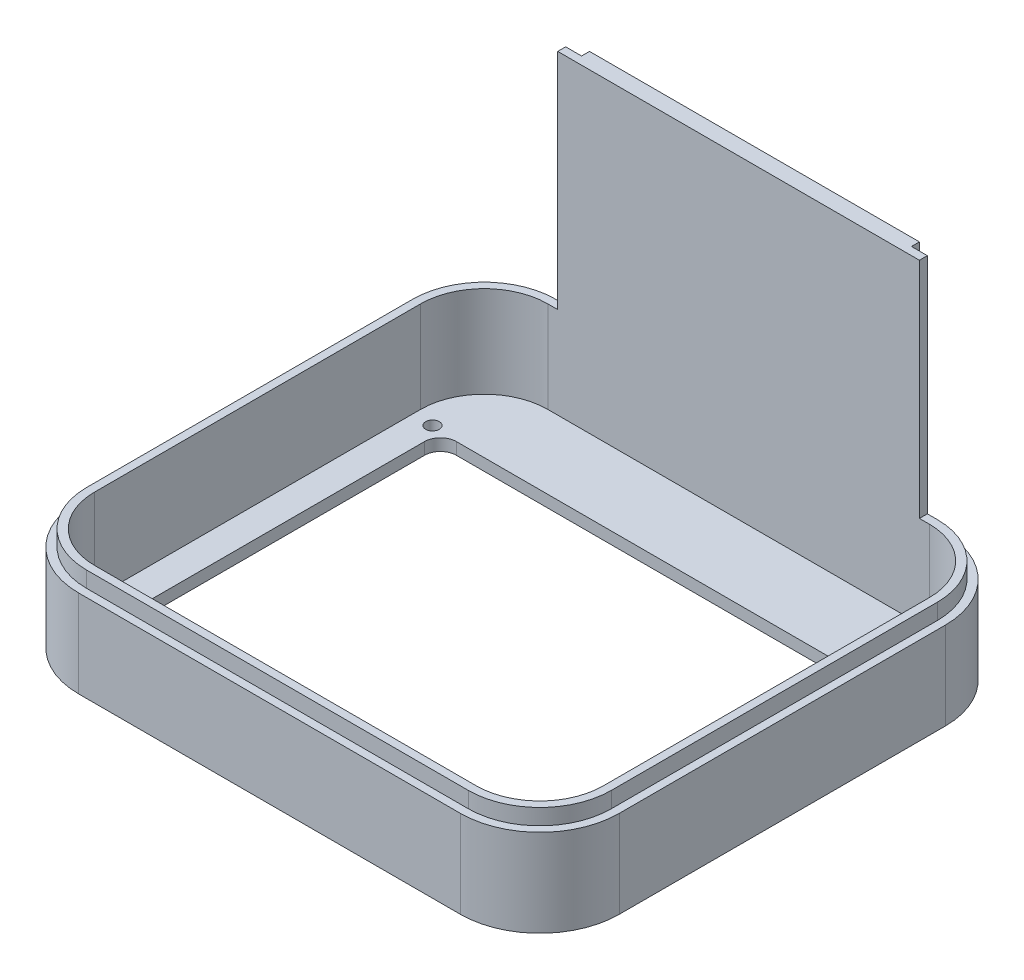
from build123d import *

# Parameters (mm, degrees)
SKETCH1_W                = 136
SKETCH1_H                = 122
BOSS_EXTRUDE1_DEPTH      = 26
FILLET1_R                = 20
SHELL1_T                 = -4
SHELL1_THICKNESS_2_DEPTH = 1
CUT_EXTRUDE1_REACH       = 96.202
SKETCH2_W                = 113
SKETCH2_H                = 77
FILLET2_R                = 4
M3_CLEARANCE_HOLE1_D     = 3.4
CUT_EXTRUDE2_DEPTH       = 4
BOSS_EXTRUDE3_DEPTH      = 56.25


with BuildPart() as part:
    # Sketch1 → Boss-Extrude1 (new body)
    with BuildSketch(Plane(origin=(0, 0, 0), x_dir=(1, 0, 0), z_dir=(0, 1, 0))):
        Rectangle(SKETCH1_W, SKETCH1_H)
    extrude(amount=BOSS_EXTRUDE1_DEPTH)

    # Fillet1
    fillet1_edges = [part.edges().sort_by_distance(p)[0] for p in [
        (68, 13, 61),
        (-68, 13, 61),
        (-68, 13, -61),
        (68, 13, -61),
    ]]
    fillet(fillet1_edges, radius=FILLET1_R)

    # Shell1
    shell1_openings = [part.faces().sort_by_distance(p)[0] for p in [
        (0, 26, 0),
    ]]
    offset(amount=SHELL1_T, openings=shell1_openings, kind=Kind.INTERSECTION)

    # Shell1 thickness 2 face (on inner face of the shell) → Shell1 thickness 2 (cut)
    with BuildSketch(Plane(origin=(0, 4, 0), x_dir=(0, 0, -1), z_dir=(0, -1, 0))):
        with BuildLine():
            ThreePointArc((57, -48), (52.313708499, -59.313708499), (41, -64))
            Line((41, -64), (-41, -64))
            ThreePointArc((-41, -64), (-52.313708499, -59.313708499), (-57, -48))
            Line((-57, -48), (-57, 48))
            ThreePointArc((-57, 48), (-52.313708499, 59.313708499), (-41, 64))
            Line((-41, 64), (41, 64))
            ThreePointArc((41, 64), (52.313708499, 59.313708499), (57, 48))
            Line((57, 48), (57, -48))
        make_face()
    extrude(amount=SHELL1_THICKNESS_2_DEPTH, mode=Mode.SUBTRACT)

    # Sketch2 → Cut-Extrude1 (cut, up to next)
    with BuildSketch(Plane(origin=(0, 3, 0), x_dir=(1, 0, 0), z_dir=(0, 1, 0)), mode=Mode.PRIVATE) as cut_extrude1_sk1:
        Rectangle(SKETCH2_W, SKETCH2_H)
    cut_extrude1_tool1 = extrude(cut_extrude1_sk1.sketch, amount=-CUT_EXTRUDE1_REACH, mode=Mode.PRIVATE) & part.part
    add(cut_extrude1_tool1.solids().sort_by_distance((0, 3, 0))[0], mode=Mode.SUBTRACT)

    # Fillet2
    fillet2_edges = [part.edges().sort_by_distance(p)[0] for p in [
        (56.5, 1.5, -38.5),
        (56.5, 1.5, 38.5),
        (-56.5, 1.5, 38.5),
        (-56.5, 1.5, -38.5),
    ]]
    fillet(fillet2_edges, radius=FILLET2_R)

    # M3 Clearance Hole1 (through all)
    with Locations(Plane(origin=(0, 3, 0), x_dir=(1, 0, 0), z_dir=(0, 1, 0))):
        with Locations((-59, 39), (59, 39), (59, -39), (-59, -39)):
            Hole(M3_CLEARANCE_HOLE1_D / 2)

    # Sketch5 → Cut-Extrude2 (cut)
    with BuildSketch(Plane(origin=(0, 26, 0), x_dir=(1, 0, 0), z_dir=(0, 1, 0))):
        with BuildLine():
            Line((-68, 41), (-68, -41))
            ThreePointArc((-68, -41), (-62.142135624, -55.142135624), (-48, -61))
            Line((-48, -61), (48, -61))
            ThreePointArc((48, -61), (62.142135624, -55.142135624), (68, -41))
            Line((68, -41), (68, 41))
            ThreePointArc((68, 41), (62.142135624, 55.142135624), (48, 61))
            Line((48, 61), (41.5, 61))
            Line((41.5, 61), (41.5, 59))
            Line((41.5, 59), (48, 59))
            ThreePointArc((48, 59), (60.727922061, 53.727922061), (66, 41))
            Line((66, 41), (66, -41))
            ThreePointArc((66, -41), (60.727922061, -53.727922061), (48, -59))
            Line((48, -59), (-48, -59))
            ThreePointArc((-48, -59), (-60.727922061, -53.727922061), (-66, -41))
            Line((-66, -41), (-66, 41))
            ThreePointArc((-66, 41), (-60.727922061, 53.727922061), (-48, 59))
            Line((-48, 59), (-41.5, 59))
            Line((-41.5, 59), (-41.5, 61))
            Line((-41.5, 61), (-48, 61))
            ThreePointArc((-48, 61), (-62.142135624, 55.142135624), (-68, 41))
        make_face()
    extrude(amount=-CUT_EXTRUDE2_DEPTH, mode=Mode.SUBTRACT)

    # Sketch9 → Boss-Extrude3 (add)
    with BuildSketch(Plane(origin=(0, 26, 0), x_dir=(1, 0, 0), z_dir=(0, 1, 0))):
        Polygon((-41.5, 61), (-41.5, 59), (-45.5, 59), (-45.5, 57), (45.5, 57), (45.5, 59), (41.5, 59), (41.5, 61), align=None)
    extrude(amount=BOSS_EXTRUDE3_DEPTH)


solid = part.part
